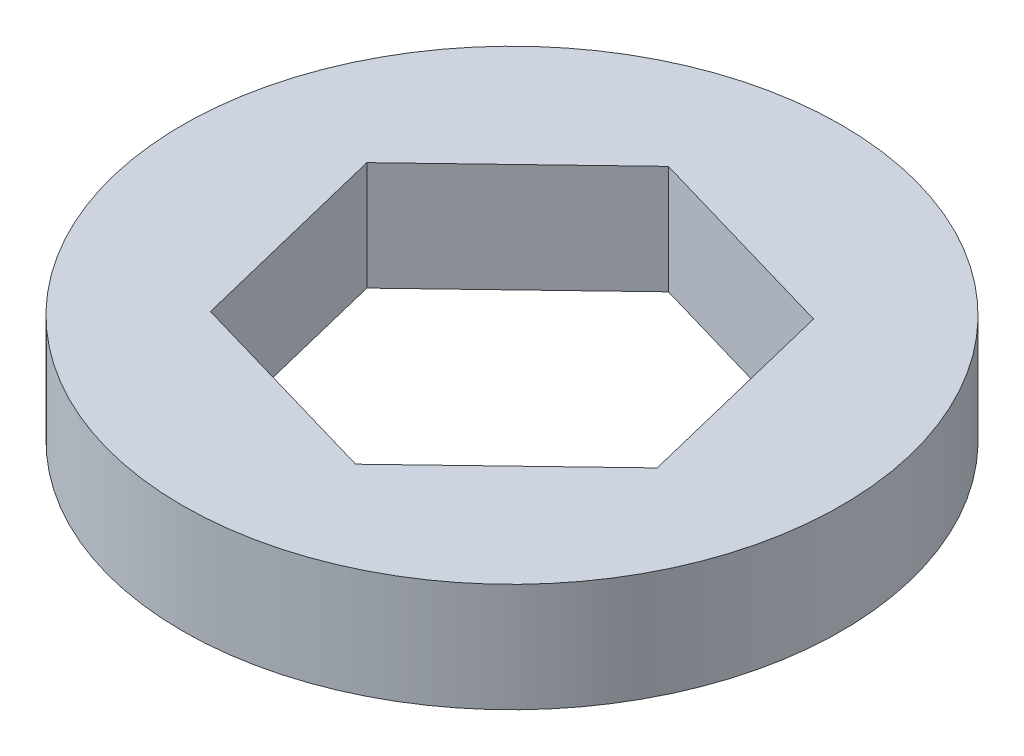
from build123d import *

# Parameters (mm, degrees)
SKETCH1_R           = 4.55
BOSS_EXTRUDE1_DEPTH = 1.5
CUT_EXTRUDE1_DEPTH  = 15


with BuildPart() as part:
    # Sketch1 → Boss-Extrude1 (new body)
    with BuildSketch(Plane(origin=(0, 0, 0), x_dir=(1, 0, 0), z_dir=(0, 1, 0))):
        with Locations(Location((0, 0, 0), (0, 0, 270))):
            Circle(SKETCH1_R)
    extrude(amount=BOSS_EXTRUDE1_DEPTH)

    # Sketch2 → Cut-Extrude1 (cut)
    with BuildSketch(Plane(origin=(0, 1.5, 0), x_dir=(1, 0, 0), z_dir=(0, 1, 0))):
        Polygon((-2.126350259, -2.036819721), (0.700762492, -2.859883202), (2.827112751, -0.823063481), (2.126350259, 2.036819721), (-0.700762492, 2.859883202), (-2.827112751, 0.823063481), align=None)
    extrude(amount=-CUT_EXTRUDE1_DEPTH, mode=Mode.SUBTRACT)


solid = part.part
